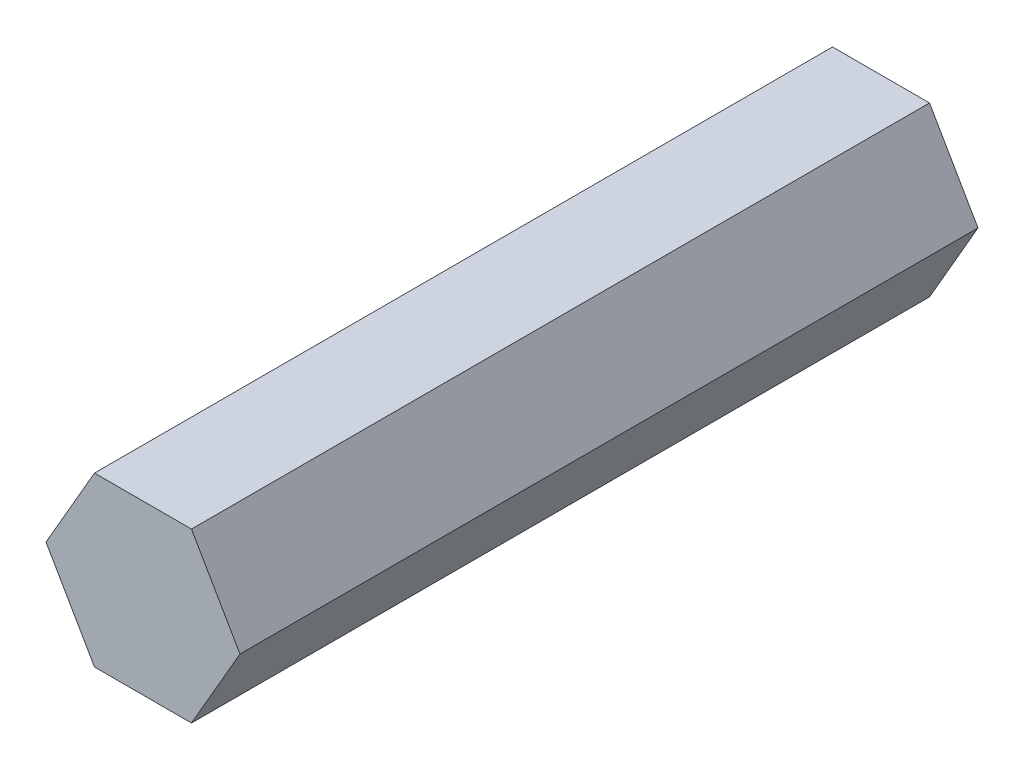
from build123d import *

# Parameters (mm, degrees)
AXIS_DEPTH = 7.6


with BuildPart() as part:
    # AxisSke → Axis (new body)
    with BuildSketch(Plane.XY):
        Polygon((0.998815966, 0), (0.499407983, 0.865), (-0.499407983, 0.865), (-0.998815966, 0), (-0.499407983, -0.865), (0.499407983, -0.865), align=None)
    extrude(amount=AXIS_DEPTH)


solid = part.part
